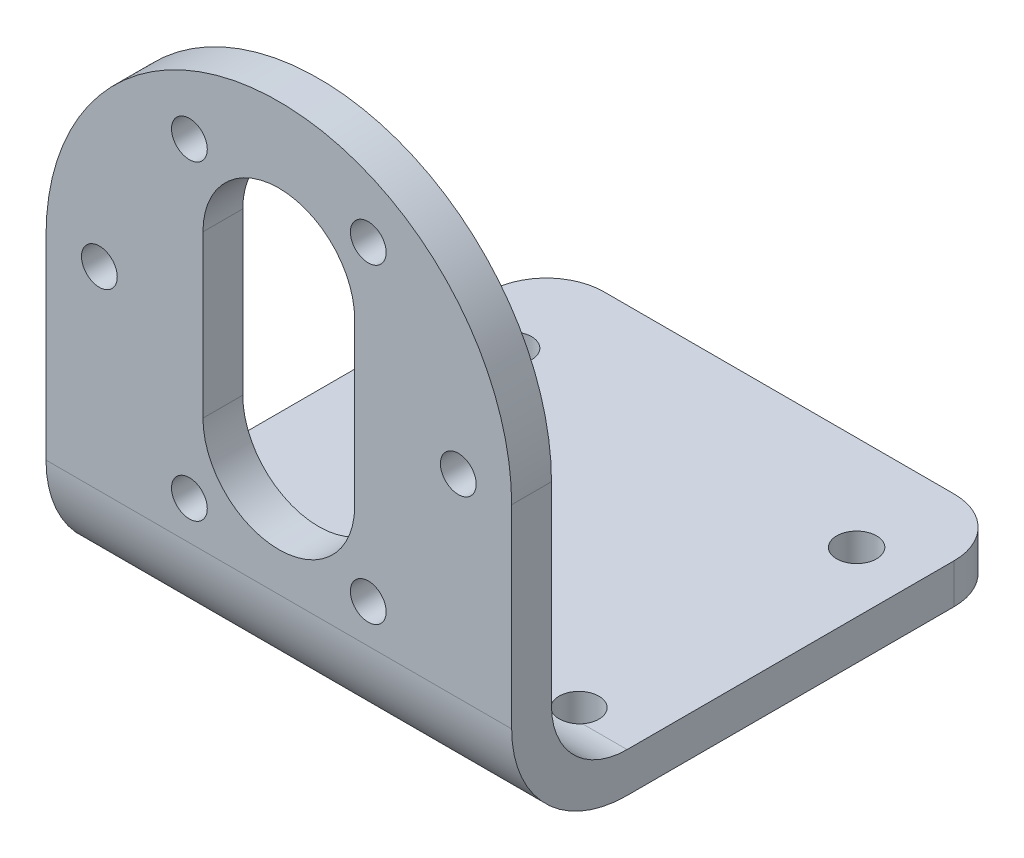
from build123d import *

# Parameters (mm, degrees)
SKETCH1_W               = 40.35
SKETCH1_H               = 43.35
BOSS_EXTRUDE1_DEPTH     = 47
CUT_EXTRUDE2_DEPTH      = 102
FILLET1_R               = 10
CUT_EXTRUDE3_DEPTH      = 102
FILLET2_R               = 5
CUT_EXTRUDE4_DEPTH      = 102
CUT_EXTRUDE4_DEPTH_BACK = 102
SKETCH6_R               = 1.73
CUT_EXTRUDE5_DEPTH      = 102
SKETCH8_R               = 1.55
CUT_EXTRUDE6_DEPTH      = 102


with BuildPart() as part:
    # Sketch1 → Boss-Extrude1 (new body)
    with BuildSketch(Plane(origin=(0, 0, 0), x_dir=(1, 0, 0), z_dir=(0, 1, 0))):
        with Locations((-26.966212793, -29.108023223)):
            Rectangle(SKETCH1_W, SKETCH1_H)
    extrude(amount=BOSS_EXTRUDE1_DEPTH)

    # Sketch3 → Cut-Extrude2 (cut)
    with BuildSketch(Plane.XY.offset(50.783023223)):
        with BuildLine():
            Line((-6.791212793, 47), (-26.966212793, 47))
            ThreePointArc((-26.966212793, 47), (-12.700333482, 41.09087931), (-6.791212793, 26.825))
            Line((-6.791212793, 26.825), (-6.791212793, 47))
        make_face()
        with BuildLine():
            Line((-47.141212793, 47), (-47.141212793, 26.825))
            ThreePointArc((-47.141212793, 26.825), (-41.232092103, 41.09087931), (-26.966212793, 47))
            Line((-26.966212793, 47), (-47.141212793, 47))
        make_face()
    extrude(amount=-CUT_EXTRUDE2_DEPTH, mode=Mode.SUBTRACT)

    # Fillet1
    fillet1_edges = [part.edges().sort_by_distance(p)[0] for p in [
        (-26.966212793, 0, 50.783023223),
    ]]
    fillet(fillet1_edges, radius=FILLET1_R)

    # Sketch5 → Cut-Extrude3 (cut)
    with BuildSketch(Plane.ZY.offset(47.141212793)):
        with BuildLine():
            Line((47.333023223, 59.778436909), (-6.665763497, 59.778436909))
            Line((-6.665763497, 59.778436909), (-6.665763497, 3.45))
            Line((-6.665763497, 3.45), (40.783023223, 3.45))
            ThreePointArc((40.783023223, 3.45), (45.41457264, 5.368450583), (47.333023223, 10))
            Line((47.333023223, 10), (47.333023223, 59.778436909))
        make_face()
    extrude(amount=-CUT_EXTRUDE3_DEPTH, mode=Mode.SUBTRACT)

    # Fillet2
    fillet2_edges = [part.edges().sort_by_distance(p)[0] for p in [
        (-6.791212793, 1.725, 7.433023223),
        (-47.141212793, 1.725, 7.433023223),
    ]]
    fillet(fillet2_edges, radius=FILLET2_R)

    # Sketch6 → Cut-Extrude4 (cut, two sides: drawn at the far end of the back side and taken through both)
    with BuildSketch(Plane(origin=(0, 3.45, 0), x_dir=(1, 0, 0), z_dir=(0, 1, 0)).offset(-CUT_EXTRUDE4_DEPTH_BACK)):
        with Locations((-41.911212793, -15.663023223)):
            Circle(SKETCH6_R)
        with Locations((-41.911212793, -39.723023223)):
            Circle(SKETCH6_R)
        with Locations((-12.021212793, -15.663023223)):
            Circle(SKETCH6_R)
        with Locations((-12.021212793, -39.723023223)):
            Circle(SKETCH6_R)
    extrude(amount=CUT_EXTRUDE4_DEPTH + CUT_EXTRUDE4_DEPTH_BACK, mode=Mode.SUBTRACT)

    # Sketch7 → Cut-Extrude5 (cut)
    with BuildSketch(Plane.XY.offset(50.783023223)):
        with BuildLine():
            ThreePointArc((-26.966212793, 40.5), (-31.615439879, 38.574227086), (-33.541212793, 33.925))
            Line((-33.541212793, 33.925), (-33.541212793, 21.982917389))
            Line((-33.541212793, 21.982917389), (-33.541212793, 19.945))
            ThreePointArc((-33.541212793, 19.945), (-26.966212793, 13.37), (-20.391212793, 19.945))
            Line((-20.391212793, 19.945), (-20.391212793, 20.41689663))
            Line((-20.391212793, 20.41689663), (-20.391212793, 33.925))
            ThreePointArc((-20.391212793, 33.925), (-22.316985706, 38.574227086), (-26.966212793, 40.5))
        make_face()
    extrude(amount=-CUT_EXTRUDE5_DEPTH, mode=Mode.SUBTRACT)

    # Sketch8 → Cut-Extrude6 (cut)
    with BuildSketch(Plane.XY.offset(50.783023223)):
        with Locations((-42.516212793, 26.825)):
            Circle(SKETCH8_R)
        with Locations((-34.716212793, 40.306097878)):
            Circle(SKETCH8_R)
        with Locations((-34.716212793, 13.343902122)):
            Circle(SKETCH8_R)
        with Locations((-19.216212793, 13.343902122)):
            Circle(SKETCH8_R)
        with Locations((-11.416212793, 26.825)):
            Circle(SKETCH8_R)
        with Locations((-19.216212793, 40.306097878)):
            Circle(SKETCH8_R)
    extrude(amount=-CUT_EXTRUDE6_DEPTH, mode=Mode.SUBTRACT)


solid = part.part
